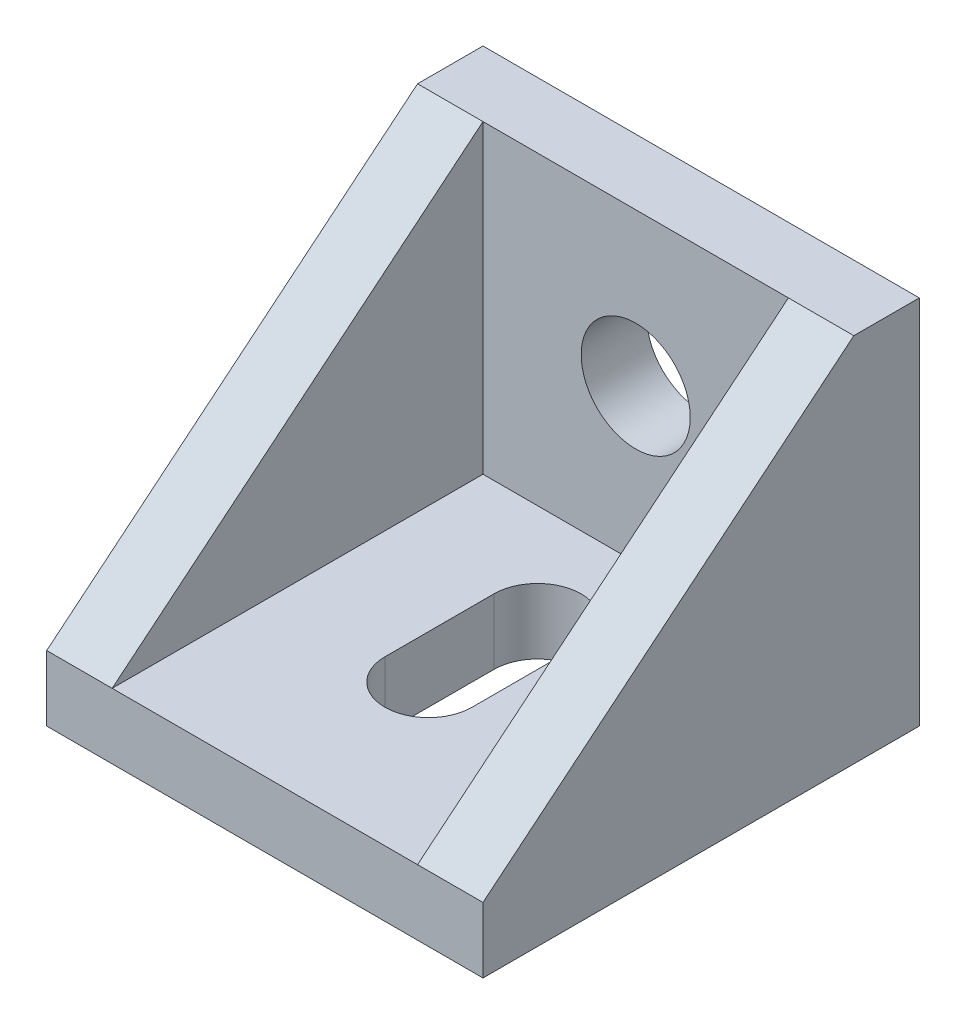
from build123d import *

# Parameters (mm, degrees)
SKETCH1_W           = 20
SKETCH1_H           = 20
BOSS_EXTRUDE1_DEPTH = 3
SKETCH2_W           = 20
SKETCH2_H           = 17
BOSS_EXTRUDE2_DEPTH = 3
BOSS_EXTRUDE3_DEPTH = 3
SKETCH4_R           = 2.5
CUT_EXTRUDE1_DEPTH  = 27.038433133
CUT_EXTRUDE2_DEPTH  = 4


with BuildPart() as part:
    # Sketch1 → Boss-Extrude1 (new body)
    with BuildSketch(Plane(origin=(0, 0, 0), x_dir=(1, 0, 0), z_dir=(0, 1, 0))):
        Rectangle(SKETCH1_W, SKETCH1_H)
    extrude(amount=BOSS_EXTRUDE1_DEPTH)

    # Sketch2 → Boss-Extrude2 (add)
    with BuildSketch(Plane(origin=(0, 0, -10), x_dir=(-1, 0, 0), z_dir=(0, 0, -1))):
        with Locations((0, 8.5)):
            Rectangle(SKETCH2_W, SKETCH2_H)
    extrude(amount=-BOSS_EXTRUDE2_DEPTH)

    # Sketch3 → Boss-Extrude3 (add)
    with BuildSketch(Plane(origin=(10, 0, 0), x_dir=(0, 0, -1), z_dir=(1, 0, 0))):
        Polygon((7, 17), (7, 3), (-10, 3), align=None)
    boss_extrude3 = extrude(amount=-BOSS_EXTRUDE3_DEPTH)

    # Mirror1: Boss-Extrude3 across plane
    add(boss_extrude3.mirror(Plane(origin=(0, 0, 0), x_dir=(0, 0, 1), z_dir=(1, 0, 0))))

    # Sketch4 → Cut-Extrude1 (cut, through all)
    with BuildSketch(Plane.XY.offset(-7)):
        with Locations((0, 10)):
            Circle(SKETCH4_R)
    extrude(amount=-CUT_EXTRUDE1_DEPTH, mode=Mode.SUBTRACT)

    # Sketch5 → Cut-Extrude2 (cut)
    with BuildSketch(Plane(origin=(0, 3, 0), x_dir=(1, 0, 0), z_dir=(0, 1, 0))):
        with BuildLine():
            Line((-2, -2.5), (-2, 2.5))
            ThreePointArc((-2, 2.5), (0, 4.5), (2, 2.5))
            Line((2, 2.5), (2, -2.5))
            ThreePointArc((2, -2.5), (0, -4.5), (-2, -2.5))
        make_face()
    extrude(amount=-CUT_EXTRUDE2_DEPTH, mode=Mode.SUBTRACT)


solid = part.part
